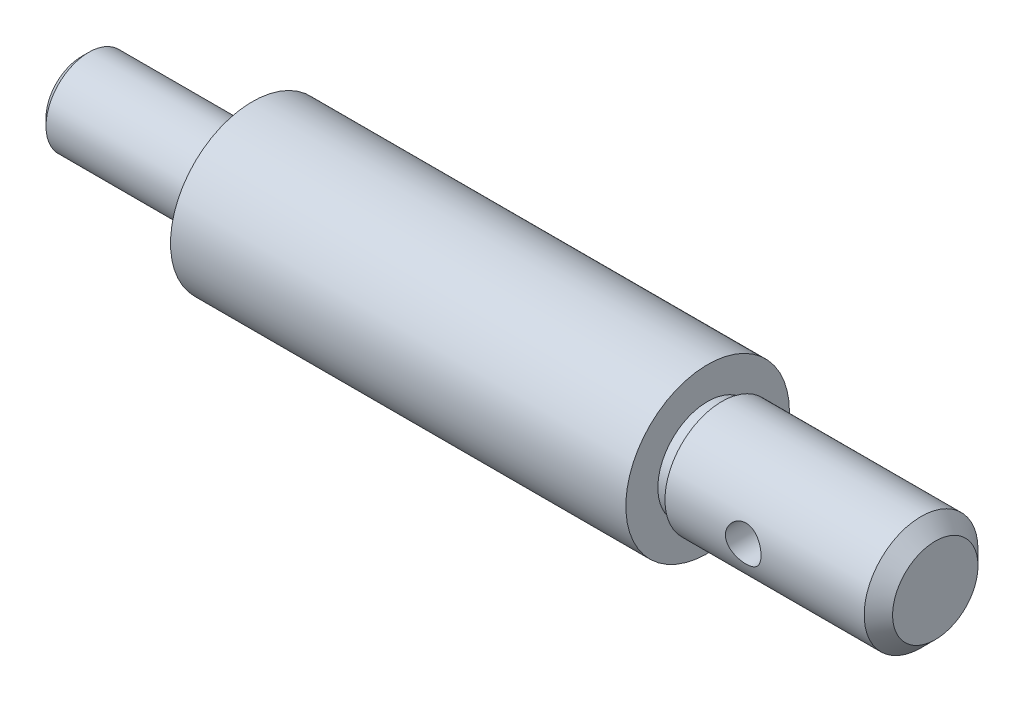
from build123d import *

# Parameters (mm, degrees)
SKETCH3_R          = 2.5
CUT_EXTRUDE1_DEPTH = 10
CHAMFER1_SIZE      = 2
CHAMFER2_SIZE      = 1


with BuildPart() as part:
    # Sketch2 → Revolve1 (revolve)
    with BuildSketch(Plane.XY, mode=Mode.PRIVATE) as revolve1_sk:
        Polygon((0, 0), (-30, 0), (-32, 0), (-96, 0), (-98, 0), (-120, 0), (-120, 6), (-98, 6), (-98, 5), (-96, 5), (-96, 11.5), (-32, 11.5), (-32, 7), (-30, 7), (-30, 8), (0, 8), align=None)
    revolve(revolve1_sk.sketch.rotate(Axis((0, 0, 0), (-1, 0, 0)), 90), axis=Axis((0, 0, 0), (-1, 0, 0)))

    # Sketch3 → Cut-Extrude1 (cut, symmetric)
    with BuildSketch(Plane.XY):
        with Locations((-19, 0)):
            Circle(SKETCH3_R)
    extrude(amount=CUT_EXTRUDE1_DEPTH, both=True, mode=Mode.SUBTRACT)

    # Chamfer1
    chamfer1_edges = [part.edges().sort_by_distance(p)[0] for p in [
        (0, 0, 8),
    ]]
    chamfer(chamfer1_edges, length=CHAMFER1_SIZE)

    # Chamfer2
    chamfer2_edges = [part.edges().sort_by_distance(p)[0] for p in [
        (-120, 0, 6),
    ]]
    chamfer(chamfer2_edges, length=CHAMFER2_SIZE)


solid = part.part
